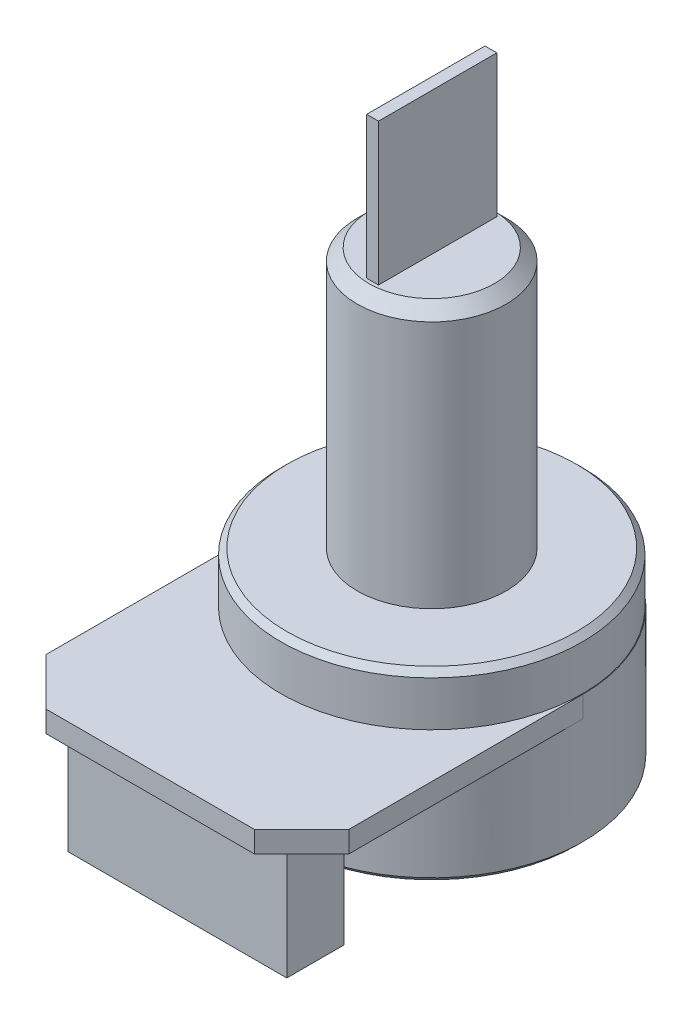
from build123d import *

# Parameters (mm, degrees)
SKETCH1_R           = 12.8
BOSS_EXTRUDE1_DEPTH = 9.5
BOSS_EXTRUDE2_DEPTH = 1.8
SKETCH3_R           = 12.75
BOSS_EXTRUDE3_DEPTH = 4.3
SKETCH4_R           = 6.3
BOSS_EXTRUDE4_DEPTH = 22
CHAMFER1_SIZE       = 1
CHAMFER2_SIZE       = 0.5
SKETCH5_W           = 18.515372874
SKETCH5_H           = 4.830097271
BOSS_EXTRUDE5_DEPTH = 10
SKETCH6_W           = 1
SKETCH6_H           = 10
BOSS_EXTRUDE6_DEPTH = 12
CHAMFER3_SIZE       = 4


with BuildPart() as part:
    # Sketch1 → Boss-Extrude1 (new body)
    with BuildSketch(Plane(origin=(0, 0, 0), x_dir=(1, 0, 0), z_dir=(0, 1, 0))):
        with Locations(Location((0, 0, 0), (0, 0, 270))):
            Circle(SKETCH1_R)
    extrude(amount=BOSS_EXTRUDE1_DEPTH)

    # Sketch2 → Boss-Extrude2 (add)
    with BuildSketch(Plane(origin=(0, 9.5, 0), x_dir=(1, 0, 0), z_dir=(0, 1, 0))):
        with BuildLine():
            Line((12.8, -23.8), (-12.8, -23.8))
            Line((-12.8, -23.8), (-12.8, 0))
            ThreePointArc((-12.8, 0), (0, 12.8), (12.8, 0))
            Line((12.8, 0), (12.8, -23.8))
        make_face()
    extrude(amount=BOSS_EXTRUDE2_DEPTH)

    # Sketch3 → Boss-Extrude3 (add)
    with BuildSketch(Plane(origin=(0, 11.3, 0), x_dir=(1, 0, 0), z_dir=(0, 1, 0))):
        with Locations(Location((0, 0, 0), (0, 0, 90))):
            Circle(SKETCH3_R)
    extrude(amount=BOSS_EXTRUDE3_DEPTH)

    # Sketch4 → Boss-Extrude4 (add)
    with BuildSketch(Plane(origin=(0, 15.6, 0), x_dir=(1, 0, 0), z_dir=(0, 1, 0))):
        with Locations(Location((0, 0, 0), (0, 0, 270))):
            Circle(SKETCH4_R)
    extrude(amount=BOSS_EXTRUDE4_DEPTH)

    # Chamfer1
    chamfer1_edges = [part.edges().sort_by_distance(p)[0] for p in [
        (0, 37.6, -6.3),
    ]]
    chamfer(chamfer1_edges, length=CHAMFER1_SIZE)

    # Chamfer2
    chamfer2_edges = [part.edges().sort_by_distance(p)[0] for p in [
        (0, 0, -12.8),
        (0, 15.6, 12.75),
    ]]
    chamfer(chamfer2_edges, length=CHAMFER2_SIZE)

    # Sketch5 → Boss-Extrude5 (add)
    with BuildSketch(Plane.XZ.offset(-9.5)):
        with Locations((0, 19.097773841)):
            Rectangle(SKETCH5_W, SKETCH5_H)
    extrude(amount=BOSS_EXTRUDE5_DEPTH)

    # Sketch6 → Boss-Extrude6 (add)
    with BuildSketch(Plane(origin=(0, 37.6, 0), x_dir=(1, 0, 0), z_dir=(0, 1, 0))):
        Rectangle(SKETCH6_W, SKETCH6_H)
    extrude(amount=BOSS_EXTRUDE6_DEPTH)

    # Chamfer3
    chamfer3_edges = [part.edges().sort_by_distance(p)[0] for p in [
        (-12.8, 10.4, 23.8),
        (12.8, 10.4, 23.8),
    ]]
    chamfer(chamfer3_edges, length=CHAMFER3_SIZE)


solid = part.part
